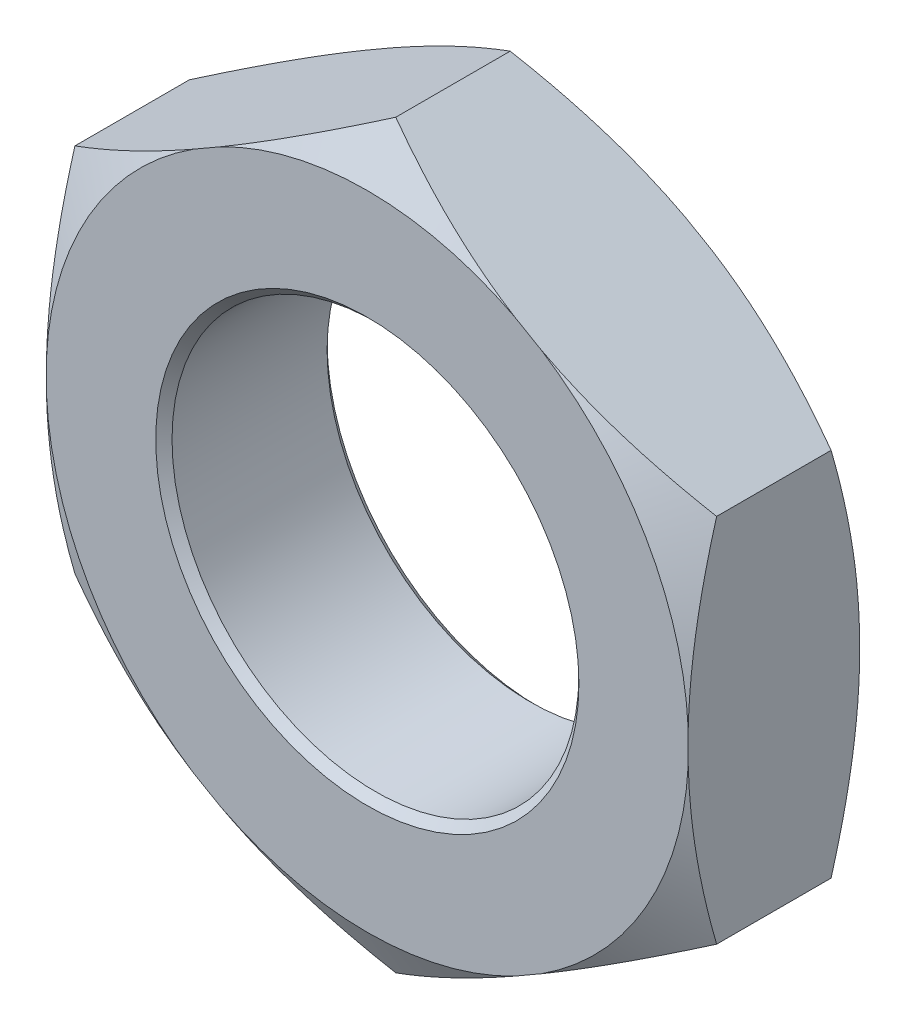
from build123d import *

# Parameters (mm, degrees)
SKETCH3_OUTSIDE_W = 46.516
SKETCH3_OUTSIDE_H = 46.516
HEX_2_DEPTH       = 26.740629363
INNERCHAMFER_SIZE = 0.38


with BuildPart() as part:
    # Sketch2 → Body (revolve)
    with BuildSketch(Plane(origin=(0, 0, 0), x_dir=(0, 0, -1), z_dir=(1, 0, 0)), mode=Mode.PRIVATE) as body_sk:
        Polygon((-4, 9.5), (-4, 15), (-2.672094381, 17.3), (2.672094381, 17.3), (4, 15), (4, 9.5), align=None)
    revolve(body_sk.sketch.rotate(Axis((0, 0, 27.389186195), (0, 0, 1)), 90), axis=Axis((0, 0, 27.389186195), (0, 0, 1)))

    # Sketch3 outside → Hex 2 (cut, through all)
    with BuildSketch(Plane.XY.offset(4)):
        Rectangle(SKETCH3_OUTSIDE_W, SKETCH3_OUTSIDE_H)
        Polygon((14.982239485, -8.65), (14.982239485, 8.65), (0, 17.3), (-14.982239485, 8.65), (-14.982239485, -8.65), (0, -17.3), align=None, mode=Mode.SUBTRACT)
    extrude(amount=-HEX_2_DEPTH, mode=Mode.SUBTRACT)

    # InnerChamfer
    innerchamfer_edges = [part.edges().sort_by_distance(p)[0] for p in [
        (9.5, 0, 4),
        (9.5, 0, -4),
    ]]
    chamfer(innerchamfer_edges, length=INNERCHAMFER_SIZE)


solid = part.part
